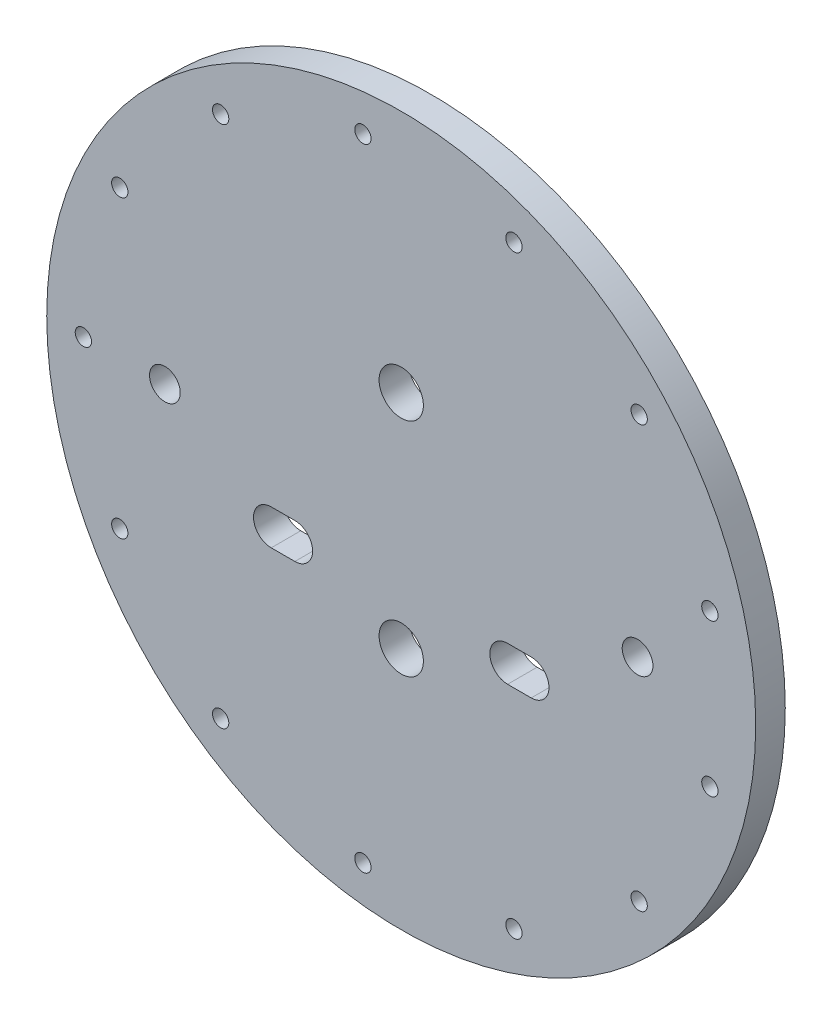
from build123d import *

# Parameters (mm, degrees)
SKETCH2_R           = 76.2
SKETCH2_R_2         = 3.302
SKETCH2_R_3         = 4.7625
BOSS_EXTRUDE1_DEPTH = 3.175
CUT_EXTRUDE1_DEPTH  = 6.35
SKETCH4_R           = 1.7526
CUT_EXTRUDE2_DEPTH  = 18.034
CIRPATTERN1_COUNT   = 13


with BuildPart() as part:
    # Sketch2 → Boss-Extrude1 (new, symmetric)
    with BuildSketch(Plane.XY):
        Circle(SKETCH2_R)
        with Locations((-50.8, 0)):
            Circle(SKETCH2_R_2, mode=Mode.SUBTRACT)
        with Locations((50.8, 0)):
            Circle(SKETCH2_R_2, mode=Mode.SUBTRACT)
        with Locations((0, 23.8125)):
            Circle(SKETCH2_R_3, mode=Mode.SUBTRACT)
        with Locations((0, -23.8125)):
            Circle(SKETCH2_R_3, mode=Mode.SUBTRACT)
    extrude(amount=BOSS_EXTRUDE1_DEPTH, both=True)

    # Sketch3 → Cut-Extrude1 (cut)
    with BuildSketch(Plane(origin=(0, 0, -3.175), x_dir=(-1, 0, 0), z_dir=(0, 0, -1))):
        with BuildLine():
            Line((-27.94, -11.43), (-22.86, -11.43))
            ThreePointArc((-22.86, -11.43), (-19.05, -15.24), (-22.86, -19.05))
            Line((-22.86, -19.05), (-27.94, -19.05))
            ThreePointArc((-27.94, -19.05), (-31.75, -15.24), (-27.94, -11.43))
        make_face()
    cut_extrude1 = extrude(amount=-CUT_EXTRUDE1_DEPTH, mode=Mode.SUBTRACT)

    # Mirror1: Cut-Extrude1 across plane
    add(cut_extrude1.mirror(Plane(origin=(0, 0, 0), x_dir=(0, 0, 1), z_dir=(1, 0, 0))), mode=Mode.SUBTRACT)

    # Sketch4 → Cut-Extrude2 (cut)
    with BuildSketch(Plane.XY.offset(3.175)):
        with Locations((-68.326, 0)):
            Circle(SKETCH4_R)
    cut_extrude2 = extrude(amount=-CUT_EXTRUDE2_DEPTH, mode=Mode.SUBTRACT)

    # CirPattern1: Cut-Extrude2 ×13 about axis
    cirpattern1_axis = Axis((0, 0, 0), (0, 0, 1))
    for i in range(1, CIRPATTERN1_COUNT):
        add(cut_extrude2.rotate(cirpattern1_axis, i * 360 / CIRPATTERN1_COUNT), mode=Mode.SUBTRACT)


solid = part.part
